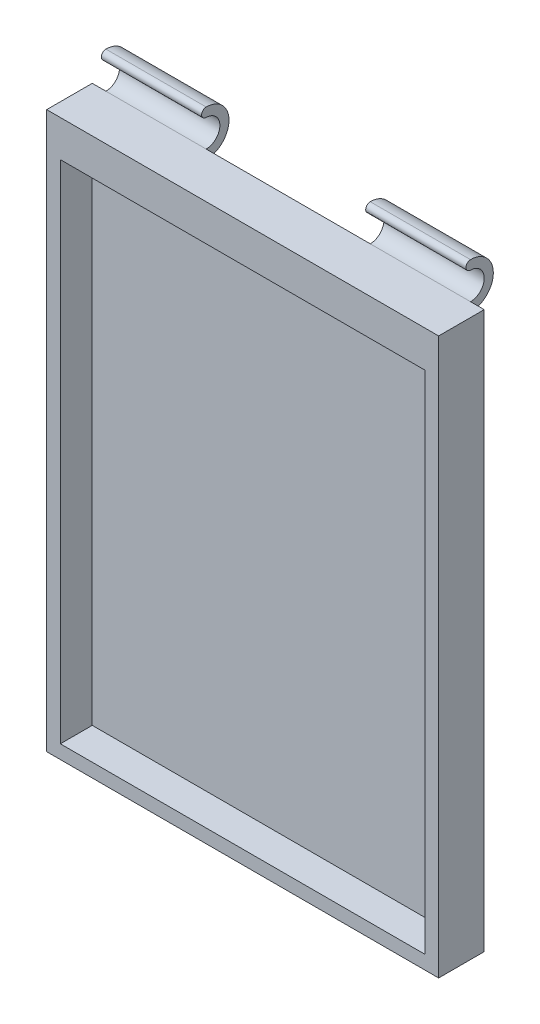
from build123d import *

# Parameters (mm, degrees)
EKRAN_TABAN_W               = 86
EKRAN_TABAN_H               = 117
EKRAN_TABAN_W_2             = 80
EKRAN_TABAN_H_2             = 111
Y_KSEKLIK_EKSTR_ZYON1_DEPTH = 10
EKRAN_TABAN_2_W             = 80
EKRAN_TABAN_2_H             = 111
Y_KSEKLIK_EKSTR_ZYON2_DEPTH = 3
Y_KSEKLIK_EKSTR_ZYON3_DEPTH = 86
IZIM6_W                     = 3
IZIM6_H                     = 15
IZIM6_W_2                   = 36
KES_EKSTR_ZYON3_DEPTH       = 10
IZIM8_W                     = 3
IZIM8_H                     = 5
IZIM8_W_2                   = 36
KES_EKSTR_ZYON5_DEPTH       = 2


with BuildPart() as part:
    # ekran_taban → Yükseklik-Ekstrüzyon1 (new body)
    with BuildSketch(Plane.XY):
        with Locations((2.953774531, 19.102589183)):
            Rectangle(EKRAN_TABAN_W, EKRAN_TABAN_H)
        with Locations((2.953774531, 19.102589183)):
            Rectangle(EKRAN_TABAN_W_2, EKRAN_TABAN_H_2, mode=Mode.SUBTRACT)
    extrude(amount=Y_KSEKLIK_EKSTR_ZYON1_DEPTH)

    # ekran_taban<2> → Yükseklik-Ekstrüzyon2 (add)
    with BuildSketch(Plane.XY):
        with Locations((2.953774531, 19.102589183)):
            Rectangle(EKRAN_TABAN_2_W, EKRAN_TABAN_2_H)
    extrude(amount=Y_KSEKLIK_EKSTR_ZYON2_DEPTH)

    # Çizim3 → Yükseklik-Ekstrüzyon3 (add)
    with BuildSketch(Plane(origin=(45.953774531, 0, 0), x_dir=(0, 0, -1), z_dir=(1, 0, 0))):
        with BuildLine():
            Line((-10, 77.602589183), (0, 77.602589183))
            Line((0, 77.602589183), (0, 80.602589183))
            ThreePointArc((0, 80.602589183), (5, 85.602589183), (0, 90.602589183))
            ThreePointArc((0, 90.602589183), (-1, 89.602589183), (0, 88.602589183))
            ThreePointArc((0, 88.602589183), (3, 85.602589183), (0, 82.602589183))
            Line((0, 82.602589183), (-10, 82.602589183))
            Line((-10, 82.602589183), (-10, 77.602589183))
        make_face()
    extrude(amount=-Y_KSEKLIK_EKSTR_ZYON3_DEPTH)

    # Çizim6 → Kes-Ekstrüzyon3 (cut)
    with BuildSketch(Plane(origin=(0, 82.602589183, 0), x_dir=(1, 0, 0), z_dir=(0, 1, 0))):
        with Locations((-38.546225469, -2.5)):
            Rectangle(IZIM6_W, IZIM6_H)
        with Locations((2.953774531, -2.5)):
            Rectangle(IZIM6_W_2, IZIM6_H)
        with Locations((44.453774531, -2.5)):
            Rectangle(IZIM6_W, IZIM6_H)
    extrude(amount=KES_EKSTR_ZYON3_DEPTH, mode=Mode.SUBTRACT)

    # Çizim8 → Kes-Ekstrüzyon5 (cut)
    with BuildSketch(Plane(origin=(0, 82.602589183, 0), x_dir=(1, 0, 0), z_dir=(0, 1, 0))):
        with Locations((-38.546225469, 2.5)):
            Rectangle(IZIM8_W, IZIM8_H)
        with Locations((44.453774531, 2.5)):
            Rectangle(IZIM8_W, IZIM8_H)
        with Locations((2.953774531, 2.5)):
            Rectangle(IZIM8_W_2, IZIM8_H)
    extrude(amount=-KES_EKSTR_ZYON5_DEPTH, mode=Mode.SUBTRACT)


solid = part.part
